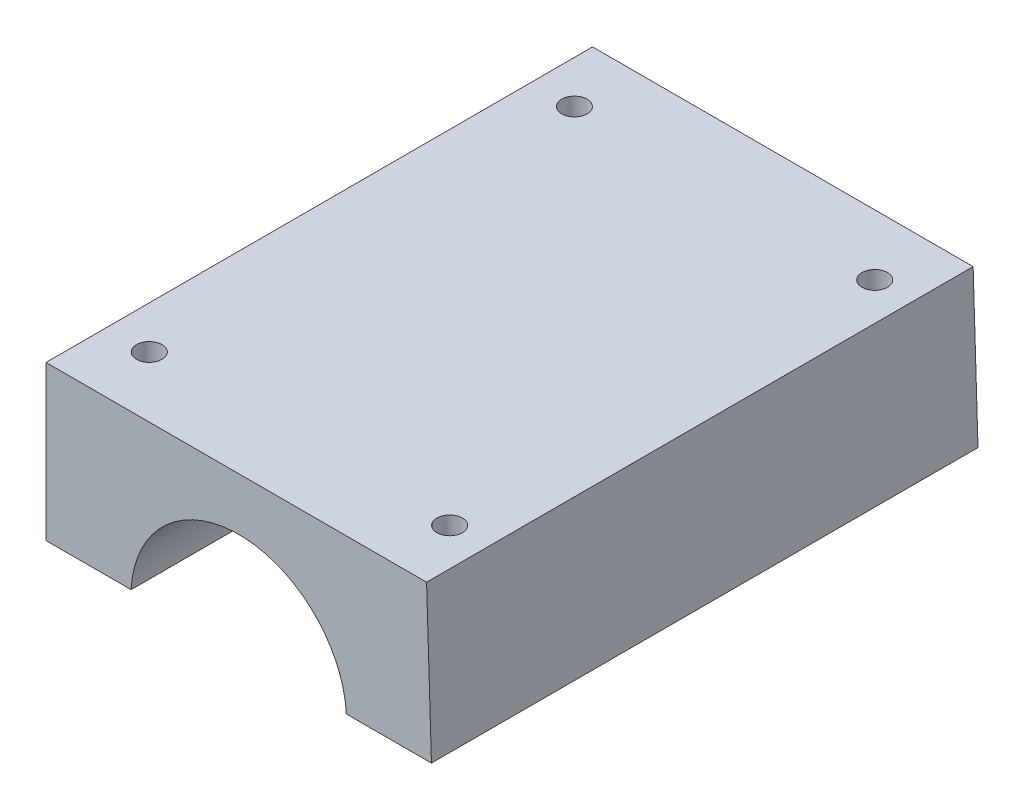
from build123d import *

# Parameters (mm, degrees)
BOSS_EXTRUDE1_DEPTH         = 90
BOSS_EXTRUDE2_DEPTH         = 90
CUT_EXTRUDE1_REACH          = 102.574
SKETCH5_W                   = 62.668099026
SKETCH5_H                   = 5.35
TAP_DRILL_FOR_M5X0_8_TAP1_D = 4.2


with BuildPart() as part:
    # Sketch1 → Boss-Extrude1 (new body)
    with BuildSketch(Plane.XY):
        with BuildLine():
            Line((-31.734248061, 1), (-17.721808598, 1))
            ThreePointArc((-17.721808598, 1), (0, 17.75), (17.721808598, 1))
            Line((17.721808598, 1), (31.734248061, 1))
            ThreePointArc((31.734248061, 1), (0, 31.75), (-31.734248061, 1))
        make_face()
    extrude(amount=BOSS_EXTRUDE1_DEPTH)

    # Sketch4 → Boss-Extrude2 (add)
    with BuildSketch(Plane(origin=(0, 0, 0), x_dir=(-1, 0, 0), z_dir=(0, 0, -1))):
        with BuildLine():
            Line((-30.765263387, 31.75), (-31.734248061, 1))
            ThreePointArc((-31.734248061, 1), (-22.094258304, 22.801452805), (0, 31.75))
            Line((0, 31.75), (-30.765263387, 31.75))
        make_face()
        with BuildLine():
            Line((31.734248061, 31.75), (0, 31.75))
            ThreePointArc((0, 31.75), (22.094258304, 22.801452805), (31.734248061, 1))
            Line((31.734248061, 1), (31.734248061, 31.75))
        make_face()
    extrude(amount=-BOSS_EXTRUDE2_DEPTH)

    # Sketch5 → Cut-Extrude1 (cut, up to next)
    with BuildSketch(Plane.XY.offset(90), mode=Mode.PRIVATE) as cut_extrude1_sk1:
        with Locations((-0.400198548, 29.075)):
            Rectangle(SKETCH5_W, SKETCH5_H)
    cut_extrude1_tool1 = extrude(cut_extrude1_sk1.sketch, amount=-CUT_EXTRUDE1_REACH, mode=Mode.PRIVATE) & part.part
    add(cut_extrude1_tool1.solids().sort_by_distance((-0.400199, 29.075, 90))[0], mode=Mode.SUBTRACT)

    # Tap Drill for M5x0.8 Tap1 (through all)
    with Locations(Plane(origin=(-24.72802833, 1, 80), x_dir=(0, 0, -1), z_dir=(0, -1, 0))):
        with Locations((0, 0), (70, 0), (0, 49.45605666), (70, 49.45605666)):
            Hole(TAP_DRILL_FOR_M5X0_8_TAP1_D / 2)


solid = part.part
